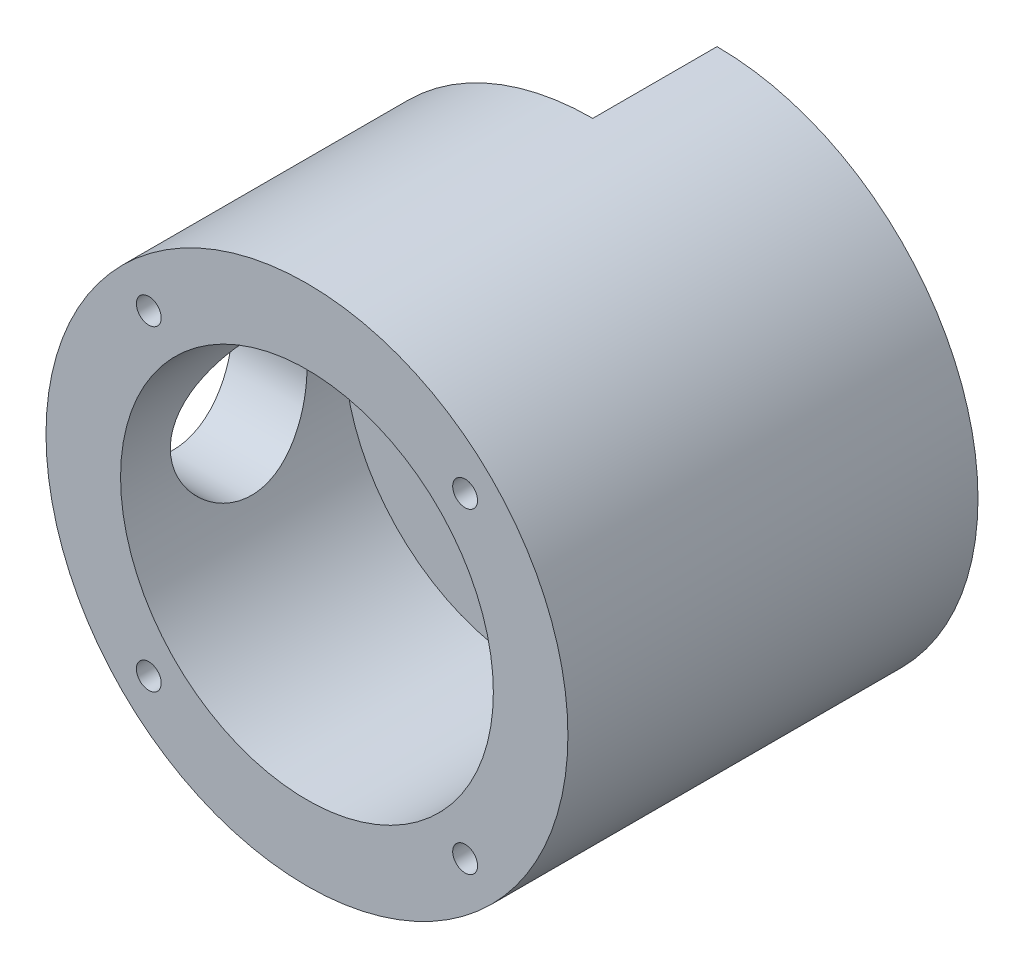
from build123d import *

# Parameters (mm, degrees)
SKETCH1_R           = 10.5
BOSS_EXTRUDE1_DEPTH = 16.5
SKETCH2_R           = 7.5
CUT_EXTRUDE1_DEPTH  = 9
SKETCH15_R          = 0.5
CUT_EXTRUDE10_DEPTH = 3
CIRPATTERN1_COUNT   = 4
SKETCH11_R          = 2.75
CUT_EXTRUDE6_DEPTH  = 23.19797288
SKETCH13_W          = 5
SKETCH13_H          = 21
CUT_EXTRUDE8_DEPTH  = 23.197973064
SKETCH14_R          = 0.5
CUT_EXTRUDE9_DEPTH  = 2


with BuildPart() as part:
    # Sketch1 → Boss-Extrude1 (new body)
    with BuildSketch(Plane.XY):
        Circle(SKETCH1_R)
    extrude(amount=BOSS_EXTRUDE1_DEPTH)

    # Sketch2 → Cut-Extrude1 (cut)
    with BuildSketch(Plane.XY.offset(16.5)):
        Circle(SKETCH2_R)
    extrude(amount=-CUT_EXTRUDE1_DEPTH, mode=Mode.SUBTRACT)

    # Sketch15 → Cut-Extrude10 (cut)
    with BuildSketch(Plane.XY.offset(16.5)):
        with Locations((6.363961031, 6.363961031)):
            Circle(SKETCH15_R)
    cut_extrude10 = extrude(amount=-CUT_EXTRUDE10_DEPTH, mode=Mode.SUBTRACT)

    # CirPattern1: Cut-Extrude10 ×4 about axis
    cirpattern1_axis = Axis((0, 0, 16.5), (0, 0, -1))
    for i in range(1, CIRPATTERN1_COUNT):
        add(cut_extrude10.rotate(cirpattern1_axis, i * 360 / CIRPATTERN1_COUNT), mode=Mode.SUBTRACT)

    # Sketch9 → Cut-Revolve1 (revolve, cut)
    with BuildSketch(Plane(origin=(0, 0, 0), x_dir=(0, 0, -1), z_dir=(1, 0, 0))):
        Polygon((-5, 0), (-5, 7.5), (-2.5, 7.5), (-2.5, 5.5), (0, 5.5), (0, 0), align=None)
    revolve(axis=Axis((0, 0, 0), (0, 0, 1)), mode=Mode.SUBTRACT)

    # Sketch11 → Cut-Extrude6 (cut, through all)
    with BuildSketch(Plane(origin=(0, 0, 0), x_dir=(0, 0, -1), z_dir=(1, 0, 0))):
        with Locations((-11.75, 0)):
            Circle(SKETCH11_R)
    extrude(amount=-CUT_EXTRUDE6_DEPTH, mode=Mode.SUBTRACT)

    # Sketch13 → Cut-Extrude8 (cut, through all)
    with BuildSketch(Plane(origin=(0, 0, 0), x_dir=(0, 0, -1), z_dir=(1, 0, 0))):
        with Locations((-2.5, 0)):
            Rectangle(SKETCH13_W, SKETCH13_H)
    extrude(amount=-CUT_EXTRUDE8_DEPTH, mode=Mode.SUBTRACT)

    # Sketch14 → Cut-Extrude9 (cut)
    with BuildSketch(Plane.ZY):
        with Locations((2.5, 9)):
            Circle(SKETCH14_R)
    cut_extrude9 = extrude(amount=-CUT_EXTRUDE9_DEPTH, mode=Mode.SUBTRACT)

    # Mirror1: Cut-Extrude9 across plane
    add(cut_extrude9.mirror(Plane.ZX), mode=Mode.SUBTRACT)


solid = part.part
